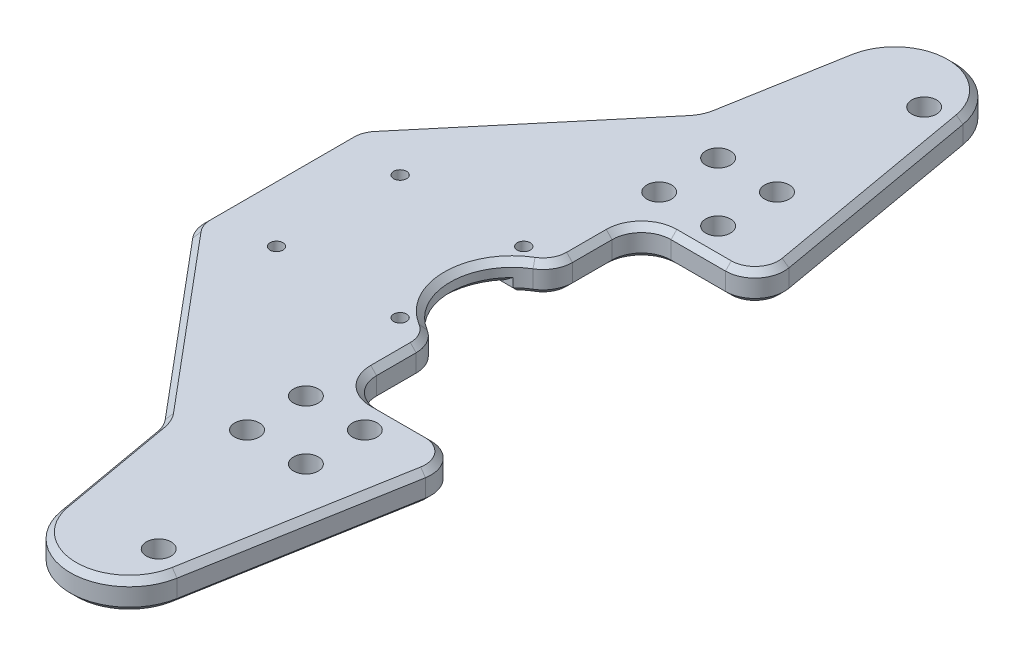
from build123d import *

# Parameters (mm, degrees)
EXTRUDE_1_DEPTH          = 2.5
SKETCH_2_R               = 2.1
CUT_EXTRUDE_1_DEPTH      = 86.14693183
SKETCH_3_R               = 1.1
CUT_EXTRUDE_2_DEPTH      = 86.14693183
SKETCH_6_W               = 36
SKETCH_6_H               = 15
CUT_EXTRUDE_3_DEPTH      = 1.5
CHAMFER_1_SIZE           = 1
CUT_EXTRUDE_4_DEPTH      = 86.14693183
CUT_EXTRUDE_4_DEPTH_BACK = 86.14693183
SKETCH_7_R               = 2.1


with BuildPart() as part:
    # 草图1 → 凸台-拉伸1 (new, symmetric)
    with BuildSketch(Plane(origin=(0, 0, 0), x_dir=(1, 0, 0), z_dir=(0, 1, 0))):
        with BuildLine():
            Line((16.172616149, -30.868240888), (9.84807753, -66.736481777))
            ThreePointArc((9.84807753, -66.736481777), (0, -75), (-9.84807753, -66.736481777))
            Line((-9.84807753, -66.736481777), (-13.366457523, -46.782757288))
            ThreePointArc((-13.366457523, -46.782757288), (-13.758957353, -45.537906868), (-14.460274073, -44.437060128))
            Line((-14.460274073, -44.437060128), (-38.830222216, -15.394086877))
            ThreePointArc((-38.830222216, -15.394086877), (-39.698463104, -13.890249545), (-40, -12.180148829))
            Line((-40, -12.180148829), (-40, 12.180148829))
            ThreePointArc((-40, 12.180148829), (-39.698463104, 13.890249545), (-38.830222216, 15.394086877))
            Line((-38.830222216, 15.394086877), (-14.460274073, 44.437060128))
            ThreePointArc((-14.460274073, 44.437060128), (-13.758957353, 45.537906868), (-13.366457523, 46.782757288))
            Line((-13.366457523, 46.782757288), (-9.84807753, 66.736481777))
            ThreePointArc((-9.84807753, 66.736481777), (0, 75), (9.84807753, 66.736481777))
            Line((9.84807753, 66.736481777), (16.172616149, 30.868240888))
            ThreePointArc((16.172616149, 30.868240888), (15.0787996, 26.786061952), (11.248577384, 25))
            Line((11.248577384, 25), (2, 25))
            ThreePointArc((2, 25), (-1.535533906, 23.535533906), (-3, 20))
            Line((-3, 20), (-3, 13.275918047))
            ThreePointArc((-3, 13.275918047), (-3.646654975, 10.816571163), (-5.419354839, 8.993363839))
            ThreePointArc((-5.419354839, 8.993363839), (-10.5, 0), (-5.419354839, -8.993363839))
            ThreePointArc((-5.419354839, -8.993363839), (-3.646654975, -10.816571163), (-3, -13.275918047))
            Line((-3, -13.275918047), (-3, -20))
            ThreePointArc((-3, -20), (-1.535533906, -23.535533906), (2, -25))
            Line((2, -25), (11.248577384, -25))
            ThreePointArc((11.248577384, -25), (15.0787996, -26.786061952), (16.172616149, -30.868240888))
        make_face()
    extrude(amount=EXTRUDE_1_DEPTH, both=True)

    # 草图2 → 切除-拉伸1 (cut, through all)
    with BuildSketch(Plane(origin=(0, 2.5, 0), x_dir=(1, 0, 0), z_dir=(0, 1, 0))):
        with Locations(Location((5, -65, 0), (0, 0, 270))):
            Circle(SKETCH_2_R)
        with Locations(Location((5, 65, 0), (0, 0, 90))):
            Circle(SKETCH_2_R)
    extrude(amount=-CUT_EXTRUDE_1_DEPTH, mode=Mode.SUBTRACT)

    # 草图3 → 切除-拉伸2 (cut, through all)
    with BuildSketch(Plane.XZ.offset(2.5)):
        with Locations(Location((-8.5, 10.5, 0), (0, 0, 270))):
            Circle(SKETCH_3_R)
        with Locations(Location((-29.5, 10.5, 0), (0, 0, 270))):
            Circle(SKETCH_3_R)
        with Locations(Location((-29.5, -10.5, 0), (0, 0, 90))):
            Circle(SKETCH_3_R)
        with Locations(Location((-8.5, -10.5, 0), (0, 0, 90))):
            Circle(SKETCH_3_R)
    extrude(amount=-CUT_EXTRUDE_2_DEPTH, mode=Mode.SUBTRACT)

    # 草图6 → 切除-拉伸3 (cut)
    with BuildSketch(Plane.XZ.offset(2.5)):
        with Locations((-18, 0)):
            Rectangle(SKETCH_6_W, SKETCH_6_H)
    extrude(amount=-CUT_EXTRUDE_3_DEPTH, mode=Mode.SUBTRACT)

    # 倒角1
    chamfer_1_edges = [part.edges().sort_by_distance(p)[0] for p in [
        (-6.427430804, -2.5, -8.302899088),
        (-21.674234614, -2.5, 7.5),
        (-10.5, -1, 0),
        (-36, -2.5, 0),
        (-21.674234614, -2.5, -7.5),
        (-1.535533906, 2.5, 23.535533906),
        (-3, 2.5, 16.637959024),
        (-3.646654975, 2.5, 10.816571163),
        (13.01034684, -2.5, 48.802361333),
        (0, -2.5, 75),
        (-11.607267527, -2.5, 56.759619532),
        (-13.758957353, -2.5, 45.537906868),
        (-26.645248144, -2.5, 29.915573502),
        (-10.5, 2.5, 0),
        (-39.698463104, -2.5, 13.890249545),
        (-40, -2.5, 0),
        (-39.698463104, -2.5, -13.890249545),
        (-26.645248144, -2.5, -29.915573502),
        (-13.758957353, -2.5, -45.537906868),
        (-11.607267527, -2.5, -56.759619532),
        (0, -2.5, -75),
        (13.01034684, -2.5, -48.802361333),
        (15.0787996, -2.5, -26.786061952),
        (6.624288692, -2.5, -25),
        (-3.646654975, 2.5, -10.816571163),
        (-1.535533906, -2.5, -23.535533906),
        (-3, -2.5, -16.637959024),
        (-3.646654975, -2.5, -10.816571163),
        (-6.427430804, -2.5, 8.302899088),
        (-3.646654975, -2.5, 10.816571163),
        (-3, -2.5, 16.637959024),
        (-1.535533906, -2.5, 23.535533906),
        (6.624288692, -2.5, 25),
        (15.0787996, -2.5, 26.786061952),
        (-3, 2.5, -16.637959024),
        (-1.535533906, 2.5, -23.535533906),
        (6.624288692, 2.5, -25),
        (15.0787996, 2.5, -26.786061952),
        (13.01034684, 2.5, -48.802361333),
        (15.0787996, 2.5, 26.786061952),
        (0, 2.5, -75),
        (-11.607267527, 2.5, -56.759619532),
        (-13.758957353, 2.5, -45.537906868),
        (-26.645248144, 2.5, -29.915573502),
        (-39.698463104, 2.5, -13.890249545),
        (-40, 2.5, 0),
        (-39.698463104, 2.5, 13.890249545),
        (-26.645248144, 2.5, 29.915573502),
        (-13.758957353, 2.5, 45.537906868),
        (-11.607267527, 2.5, 56.759619532),
        (6.624288692, 2.5, 25),
        (0, 2.5, 75),
        (13.01034684, 2.5, 48.802361333),
    ]]
    chamfer(chamfer_1_edges, length=CHAMFER_1_SIZE)

    # 草图7 → 切除-拉伸4 (cut, two sides: drawn at the far end of the back side and taken through both)
    with BuildSketch(Plane(origin=(0, 2.5, 0), x_dir=(1, 0, 0), z_dir=(0, 1, 0)).offset(-CUT_EXTRUDE_4_DEPTH_BACK)):
        with Locations(Location((-5, 40, 0), (0, 0, 270))):
            Circle(SKETCH_7_R)
        with Locations(Location((5, 40, 0), (0, 0, 270))):
            Circle(SKETCH_7_R)
        with Locations(Location((5, -40, 0), (0, 0, 90))):
            Circle(SKETCH_7_R)
        with Locations(Location((-5, -40, 0), (0, 0, 90))):
            Circle(SKETCH_7_R)
        with Locations(Location((-5, 30, 0), (0, 0, 270))):
            Circle(SKETCH_7_R)
        with Locations(Location((5, 30, 0), (0, 0, 270))):
            Circle(SKETCH_7_R)
        with Locations(Location((5, -30, 0), (0, 0, 90))):
            Circle(SKETCH_7_R)
        with Locations(Location((-5, -30, 0), (0, 0, 90))):
            Circle(SKETCH_7_R)
    extrude(amount=CUT_EXTRUDE_4_DEPTH + CUT_EXTRUDE_4_DEPTH_BACK, mode=Mode.SUBTRACT)


solid = part.part
